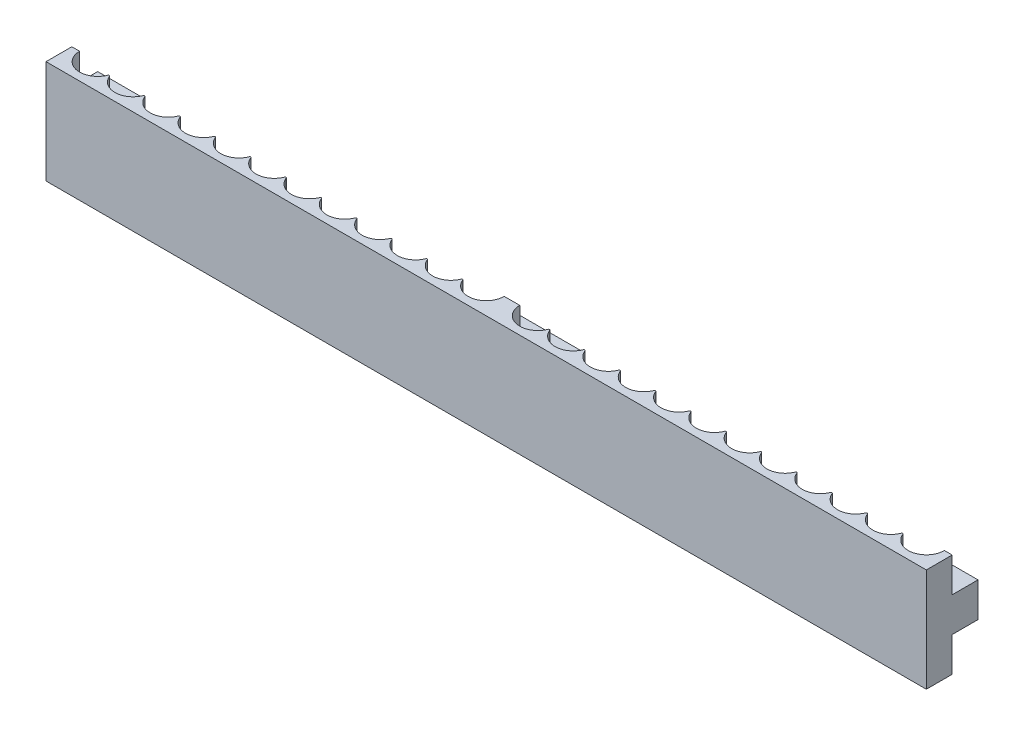
from build123d import *

# Parameters (mm, degrees)
BOSS_EXTRUDE5_DEPTH = 30
BOSS_EXTRUDE6_DEPTH = 10


with BuildPart() as part:
    # Sketch1 → Boss-Extrude5 (new, symmetric)
    with BuildSketch(Plane(origin=(0, 0, 0), x_dir=(1, 0, 0), z_dir=(0, 1, 0))):
        with BuildLine():
            Line((245, 0), (236, 0))
            ThreePointArc((236, 0), (227.438690983, -10.319470785), (215.715909091, -3.810717135))
            ThreePointArc((215.715909091, -3.810717135), (215.25, -3.492179856), (214.784090909, -3.810717135))
            ThreePointArc((214.784090909, -3.810717135), (205, -10.5), (195.215909091, -3.810717135))
            ThreePointArc((195.215909091, -3.810717135), (194.75, -3.492179856), (194.284090909, -3.810717135))
            ThreePointArc((194.284090909, -3.810717135), (184.5, -10.5), (174.715909091, -3.810717135))
            ThreePointArc((174.715909091, -3.810717135), (174.25, -3.492179856), (173.784090909, -3.810717135))
            ThreePointArc((173.784090909, -3.810717135), (164, -10.5), (154.215909091, -3.810717135))
            ThreePointArc((154.215909091, -3.810717135), (153.75, -3.492179856), (153.284090909, -3.810717135))
            ThreePointArc((153.284090909, -3.810717135), (143.5, -10.5), (133.715909091, -3.810717135))
            ThreePointArc((133.715909091, -3.810717135), (133.25, -3.492179856), (132.784090909, -3.810717135))
            ThreePointArc((132.784090909, -3.810717135), (123, -10.5), (113.215909091, -3.810717135))
            ThreePointArc((113.215909091, -3.810717135), (112.75, -3.492179856), (112.284090909, -3.810717135))
            ThreePointArc((112.284090909, -3.810717135), (102.5, -10.5), (92.715909091, -3.810717135))
            ThreePointArc((92.715909091, -3.810717135), (92.25, -3.492179856), (91.784090909, -3.810717135))
            ThreePointArc((91.784090909, -3.810717135), (82, -10.5), (72.215909091, -3.810717135))
            ThreePointArc((72.215909091, -3.810717135), (71.75, -3.492179856), (71.284090909, -3.810717135))
            ThreePointArc((71.284090909, -3.810717135), (61.5, -10.5), (51.715909091, -3.810717135))
            ThreePointArc((51.715909091, -3.810717135), (51.25, -3.492179856), (50.784090909, -3.810717135))
            ThreePointArc((50.784090909, -3.810717135), (41, -10.5), (31.215909091, -3.810717135))
            ThreePointArc((31.215909091, -3.810717135), (30.75, -3.492179856), (30.284090909, -3.810717135))
            ThreePointArc((30.284090909, -3.810717135), (20.5, -10.5), (10.715909091, -3.810717135))
            ThreePointArc((10.715909091, -3.810717135), (10.25, -3.492179856), (9.784090909, -3.810717135))
            ThreePointArc((9.784090909, -3.810717135), (-1.938690983, -10.319470785), (-10.5, 0))
            Line((-10.5, 0), (-15, 0))
            Line((-15, 0), (-15, -15))
            Line((-15, -15), (496, -15))
            Line((496, -15), (496, 0))
            Line((496, 0), (491.5, 0))
            ThreePointArc((491.5, 0), (482.938690983, -10.319470785), (471.215909091, -3.810717135))
            ThreePointArc((471.215909091, -3.810717135), (470.75, -3.492179856), (470.284090909, -3.810717135))
            ThreePointArc((470.284090909, -3.810717135), (460.5, -10.5), (450.715909091, -3.810717135))
            ThreePointArc((450.715909091, -3.810717135), (450.25, -3.492179856), (449.784090909, -3.810717135))
            ThreePointArc((449.784090909, -3.810717135), (440, -10.5), (430.215909091, -3.810717135))
            ThreePointArc((430.215909091, -3.810717135), (429.75, -3.492179856), (429.284090909, -3.810717135))
            ThreePointArc((429.284090909, -3.810717135), (419.5, -10.5), (409.715909091, -3.810717135))
            ThreePointArc((409.715909091, -3.810717135), (409.25, -3.492179856), (408.784090909, -3.810717135))
            ThreePointArc((408.784090909, -3.810717135), (399, -10.5), (389.215909091, -3.810717135))
            ThreePointArc((389.215909091, -3.810717135), (388.75, -3.492179856), (388.284090909, -3.810717135))
            ThreePointArc((388.284090909, -3.810717135), (378.5, -10.5), (368.715909091, -3.810717135))
            ThreePointArc((368.715909091, -3.810717135), (368.25, -3.492179856), (367.784090909, -3.810717135))
            ThreePointArc((367.784090909, -3.810717135), (358, -10.5), (348.215909091, -3.810717135))
            ThreePointArc((348.215909091, -3.810717135), (347.75, -3.492179856), (347.284090909, -3.810717135))
            ThreePointArc((347.284090909, -3.810717135), (337.5, -10.5), (327.715909091, -3.810717135))
            ThreePointArc((327.715909091, -3.810717135), (327.25, -3.492179856), (326.784090909, -3.810717135))
            ThreePointArc((326.784090909, -3.810717135), (317, -10.5), (307.215909091, -3.810717135))
            ThreePointArc((307.215909091, -3.810717135), (306.75, -3.492179856), (306.284090909, -3.810717135))
            ThreePointArc((306.284090909, -3.810717135), (296.5, -10.5), (286.715909091, -3.810717135))
            ThreePointArc((286.715909091, -3.810717135), (286.25, -3.492179856), (285.784090909, -3.810717135))
            ThreePointArc((285.784090909, -3.810717135), (276, -10.5), (266.215909091, -3.810717135))
            ThreePointArc((266.215909091, -3.810717135), (265.75, -3.492179856), (265.284090909, -3.810717135))
            ThreePointArc((265.284090909, -3.810717135), (253.561309017, -10.319470785), (245, 0))
        make_face()
    extrude(amount=BOSS_EXTRUDE5_DEPTH, both=True)

    # Sketch6 → Boss-Extrude6 (add, symmetric)
    with BuildSketch(Plane(origin=(0, 0, 0), x_dir=(1, 0, 0), z_dir=(0, 1, 0))):
        Polygon((-15, -15), (496, -15), (496, 15), (470.5, 15), (470.5, 0), (266, 0), (266, 15), (215, 15), (215, 0), (10.5, 0), (10.5, 15), (-15, 15), align=None)
    extrude(amount=BOSS_EXTRUDE6_DEPTH, both=True)


solid = part.part
